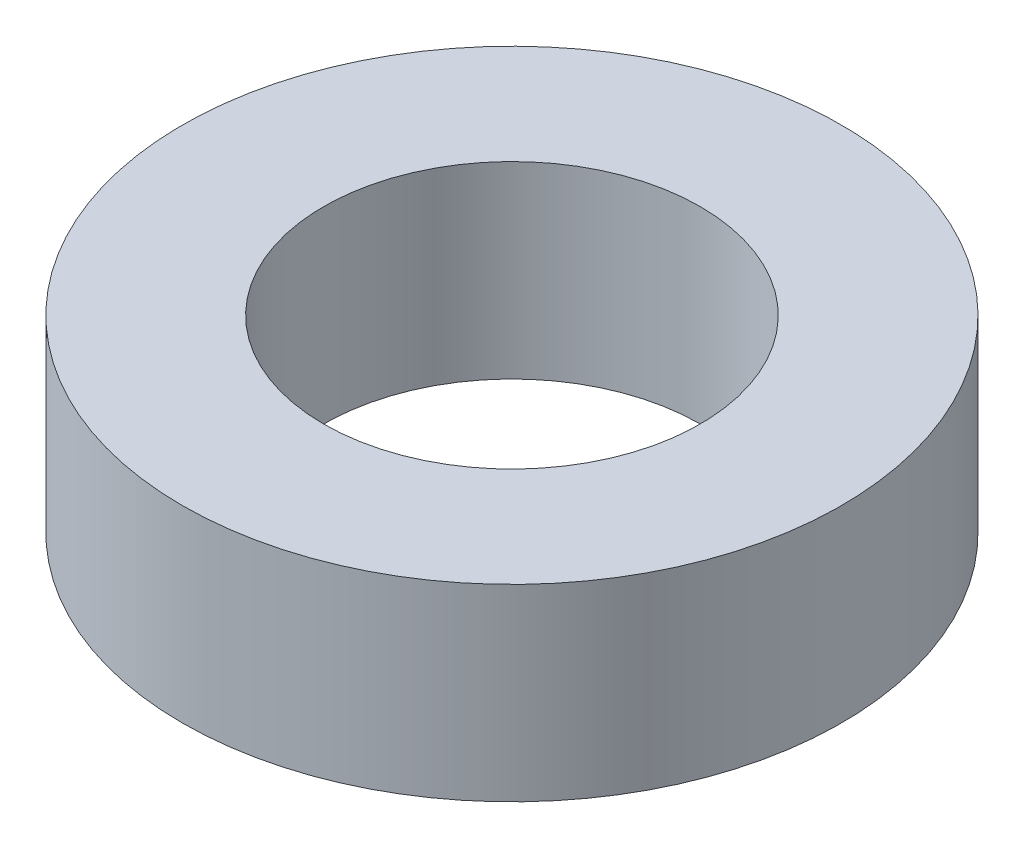
from build123d import *

# Parameters (mm, degrees)
SKETCH1_R           = 11.1125
BOSS_EXTRUDE1_DEPTH = 6.35
SKETCH2_R           = 6.35
CUT_EXTRUDE1_DEPTH  = 17.949861725


with BuildPart() as part:
    # Sketch1 → Boss-Extrude1 (new body)
    with BuildSketch(Plane(origin=(0, 0, 0), x_dir=(1, 0, 0), z_dir=(0, 1, 0))):
        with Locations(Location((0, 0, 0), (0, 0, 270))):
            Circle(SKETCH1_R)
    extrude(amount=BOSS_EXTRUDE1_DEPTH)

    # Sketch2 → Cut-Extrude1 (cut, through all)
    with BuildSketch(Plane(origin=(0, 6.35, 0), x_dir=(1, 0, 0), z_dir=(0, 1, 0))):
        with Locations(Location((0, 0, 0), (0, 0, 270))):
            Circle(SKETCH2_R)
    extrude(amount=-CUT_EXTRUDE1_DEPTH, mode=Mode.SUBTRACT)


solid = part.part
